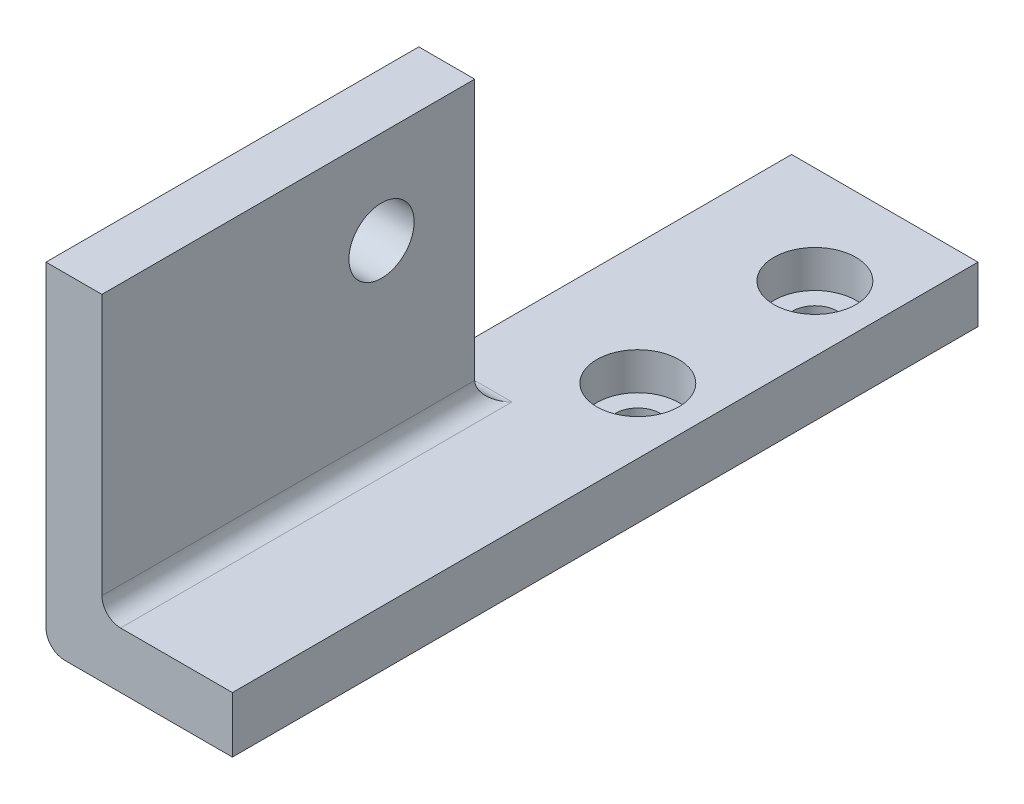
from build123d import *

# Parameters (mm, degrees)
SKETCH1_W                      = 10
SKETCH1_H                      = 20
SKETCH1_R                      = 1.175
BOSS_EXTRUDE1_DEPTH            = 3
CBORE_FOR_M2_SHCS1_D           = 2.4
CBORE_FOR_M2_SHCS1_CBORE_D     = 4.4
CBORE_FOR_M2_SHCS1_CBORE_DEPTH = 2
SKETCH6_W                      = 10
SKETCH6_H                      = 3
BOSS_EXTRUDE2_DEPTH            = 20
SKETCH8_W                      = 3
SKETCH8_H                      = 20
BOSS_EXTRUDE3_DEPTH            = 15
SKETCH9_R                      = 1.75
CUT_EXTRUDE1_DEPTH             = 28.802877549
FILLET1_R                      = 1
FILLET2_R                      = 1


with BuildPart() as part:
    # Sketch1 → Boss-Extrude1 (new body)
    with BuildSketch(Plane(origin=(0, 0, 0), x_dir=(1, 0, 0), z_dir=(0, 1, 0))):
        with Locations((5, 10)):
            Rectangle(SKETCH1_W, SKETCH1_H)
        with Locations(Location((6.5, 5.25, 0), (0, 0, 270))):
            Circle(SKETCH1_R, mode=Mode.SUBTRACT)
        with Locations(Location((6.5, 14.75, 0), (0, 0, 270))):
            Circle(SKETCH1_R, mode=Mode.SUBTRACT)
    extrude(amount=BOSS_EXTRUDE1_DEPTH)

    # CBORE for M2 SHCS1 (through all)
    with Locations(Plane(origin=(0, 3, 0), x_dir=(1, 0, 0), z_dir=(0, 1, 0))):
        with Locations((6.5, 14.75), (6.5, 5.25)):
            CounterBoreHole(CBORE_FOR_M2_SHCS1_D / 2, CBORE_FOR_M2_SHCS1_CBORE_D / 2, CBORE_FOR_M2_SHCS1_CBORE_DEPTH)

    # Sketch6 → Boss-Extrude2 (add)
    with BuildSketch(Plane(origin=(0, 0, 0), x_dir=(-1, 0, 0), z_dir=(0, 0, -1))):
        with Locations((-5, 1.5)):
            Rectangle(SKETCH6_W, SKETCH6_H)
    extrude(amount=-BOSS_EXTRUDE2_DEPTH)

    # Sketch8 → Boss-Extrude3 (add)
    with BuildSketch(Plane(origin=(0, 3, 0), x_dir=(1, 0, 0), z_dir=(0, 1, 0))):
        with Locations((1.5, -10)):
            Rectangle(SKETCH8_W, SKETCH8_H)
    extrude(amount=BOSS_EXTRUDE3_DEPTH)

    # Sketch9 → Cut-Extrude1 (cut, through all)
    with BuildSketch(Plane(origin=(3, 0, 0), x_dir=(0, 0, -1), z_dir=(1, 0, 0))):
        with Locations((-5, 13)):
            Circle(SKETCH9_R)
    extrude(amount=-CUT_EXTRUDE1_DEPTH, mode=Mode.SUBTRACT)

    # Fillet1
    fillet1_edges = [part.edges().sort_by_distance(p)[0] for p in [
        (3, 3, 10),
        (1.5, 3, 0),
    ]]
    fillet(fillet1_edges, radius=FILLET1_R)

    # Fillet2
    fillet2_edges = [part.edges().sort_by_distance(p)[0] for p in [
        (0, 0, 0),
    ]]
    fillet(fillet2_edges, radius=FILLET2_R)


solid = part.part
